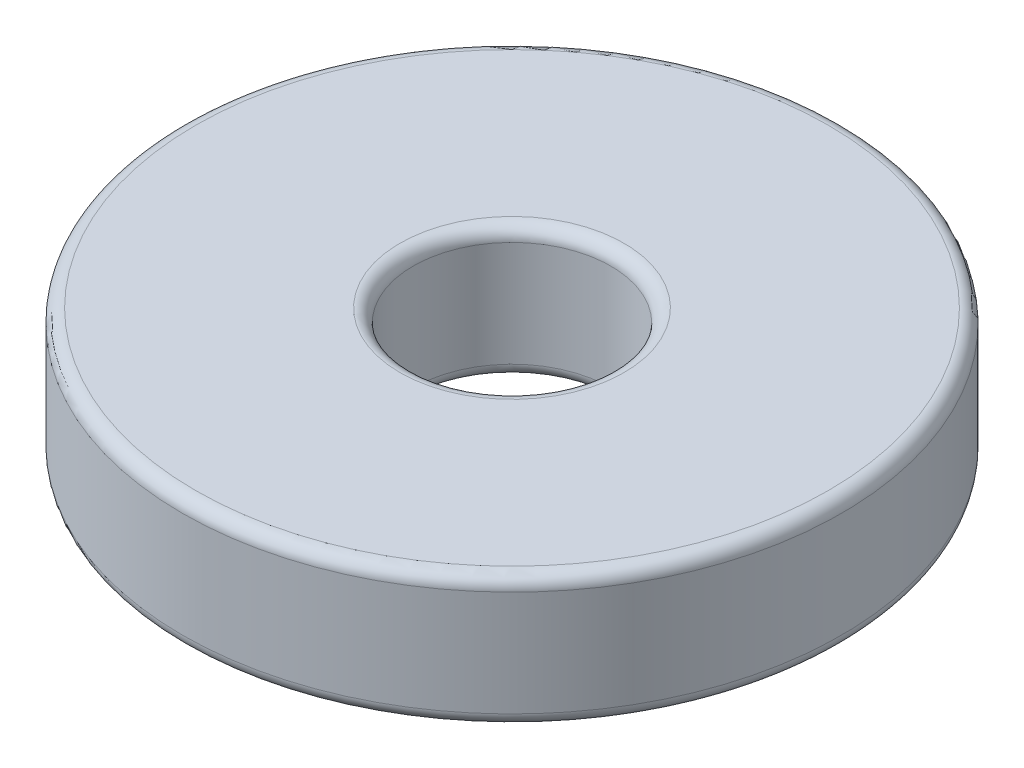
from build123d import *

# Parameters (mm, degrees)
SKETCH1_R           = 25
SKETCH1_R_2         = 7.5
BOSS_EXTRUDE1_DEPTH = 5
FILLET1_R           = 1


with BuildPart() as part:
    # Sketch1 → Boss-Extrude1 (new, symmetric)
    with BuildSketch(Plane(origin=(0, 0, 0), x_dir=(1, 0, 0), z_dir=(0, 1, 0))):
        with Locations(Location((0, 0, 0), (0, 0, 270))):
            Circle(SKETCH1_R)
        with Locations(Location((0, 0, 0), (0, 0, 270))):
            Circle(SKETCH1_R_2, mode=Mode.SUBTRACT)
    extrude(amount=BOSS_EXTRUDE1_DEPTH, both=True)

    # Fillet1
    fillet1_edges = [part.edges().sort_by_distance(p)[0] for p in [
        (0, -5, -25),
        (0, 5, -25),
        (0, -5, -7.5),
        (0, 5, -7.5),
    ]]
    fillet(fillet1_edges, radius=FILLET1_R)


solid = part.part
